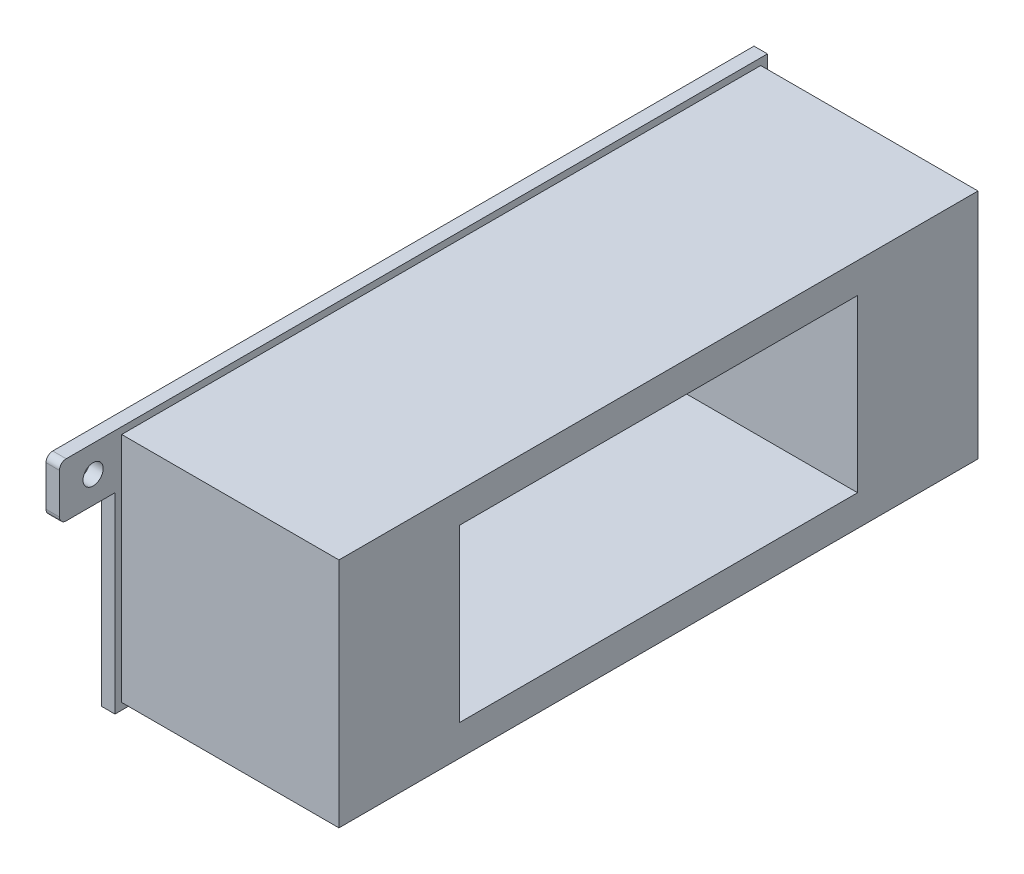
from build123d import *

# Parameters (mm, degrees)
BOSS_EXTRUDE1_DEPTH = 95
SKETCH2_R           = 1.5
BOSS_EXTRUDE2_DEPTH = 2
SKETCH3_W           = 59.18
SKETCH3_H           = 25.4
CUT_EXTRUDE1_DEPTH  = 129.525100261


with BuildPart() as part:
    # Sketch1 → Boss-Extrude1 (new body)
    with BuildSketch(Plane.XY):
        Polygon((40.869322236, 66.889079057), (40.869322236, 30.389079057), (42.869322236, 30.389079057), (42.869322236, 31.389079057), (75.169322236, 31.389079057), (75.169322236, 65.889079057), (42.869322236, 65.889079057), (42.869322236, 66.889079057), align=None)
    extrude(amount=BOSS_EXTRUDE1_DEPTH)

    # Sketch2 → Boss-Extrude2 (add)
    # profile 1 of 2: a face of its own
    with BuildSketch(Plane.ZY.offset(-40.869322236)):
        with BuildLine():
            Line((-1, 38.389079057), (-8.25, 38.389079057))
            ThreePointArc((-8.25, 38.389079057), (-8.957106781, 38.096185839), (-9.25, 37.389079057))
            Line((-9.25, 37.389079057), (-9.25, 31.389079057))
            ThreePointArc((-9.25, 31.389079057), (-8.957106781, 30.681972276), (-8.25, 30.389079057))
            Line((-8.25, 30.389079057), (0, 30.389079057))
            Line((0, 30.389079057), (0, 38.389079057))
            Line((0, 38.389079057), (0, 66.889079057))
            Line((0, 66.889079057), (-1, 66.889079057))
            Line((-1, 66.889079057), (-1, 38.389079057))
        make_face()
        with Locations((-4.25, 34.389079057)):
            Circle(SKETCH2_R, mode=Mode.SUBTRACT)
    # profile 2 of 2: a face of its own
    with BuildSketch(Plane.ZY.offset(-40.869322236)):
        with BuildLine():
            Line((95, 66.889079057), (103.25, 66.889079057))
            ThreePointArc((103.25, 66.889079057), (103.957106781, 66.596185839), (104.25, 65.889079057))
            Line((104.25, 65.889079057), (104.25, 59.889079057))
            ThreePointArc((104.25, 59.889079057), (103.957106781, 59.181972276), (103.25, 58.889079057))
            Line((103.25, 58.889079057), (96, 58.889079057))
            Line((96, 58.889079057), (96, 30.389079057))
            Line((96, 30.389079057), (95, 30.389079057))
            Line((95, 30.389079057), (95, 58.889079057))
            Line((95, 58.889079057), (95, 66.889079057))
        make_face()
        with Locations((99.25, 62.889079057)):
            Circle(SKETCH2_R, mode=Mode.SUBTRACT)
    extrude(amount=-BOSS_EXTRUDE2_DEPTH)

    # Sketch3 → Cut-Extrude1 (cut, through all)
    with BuildSketch(Plane.ZY.offset(-40.869322236)):
        with Locations((47.49, 48.689079057)):
            Rectangle(SKETCH3_W, SKETCH3_H)
    extrude(amount=-CUT_EXTRUDE1_DEPTH, mode=Mode.SUBTRACT)


solid = part.part
